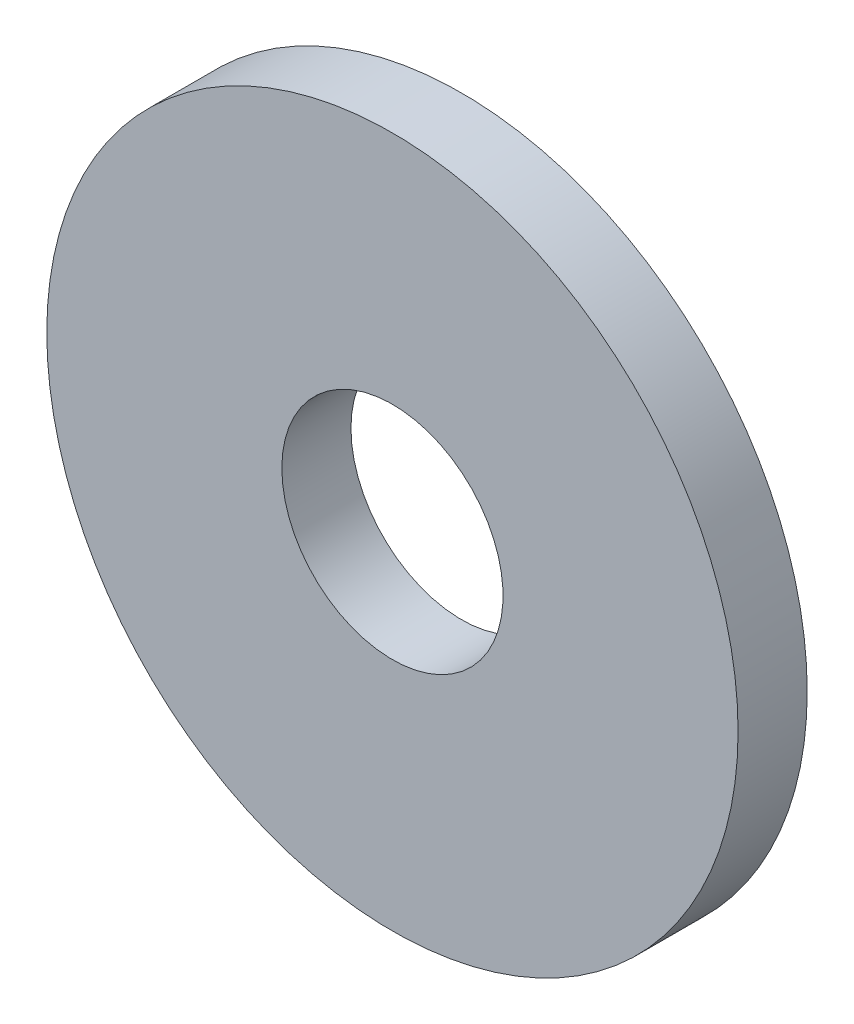
from build123d import *

# Parameters (mm, degrees)
SKETCH1_W = 3.4
SKETCH1_H = 1


with BuildPart() as part:
    # Sketch1 → Revolve1 (revolve)
    with BuildSketch(Plane.XZ, mode=Mode.PRIVATE) as revolve1_sk:
        with Locations((3.3, 0.5)):
            Rectangle(SKETCH1_W, SKETCH1_H)
    revolve(revolve1_sk.sketch.rotate(Axis((0, 0, 1), (0, 0, -1)), 180), axis=Axis((0, 0, 1), (0, 0, -1)))


solid = part.part
